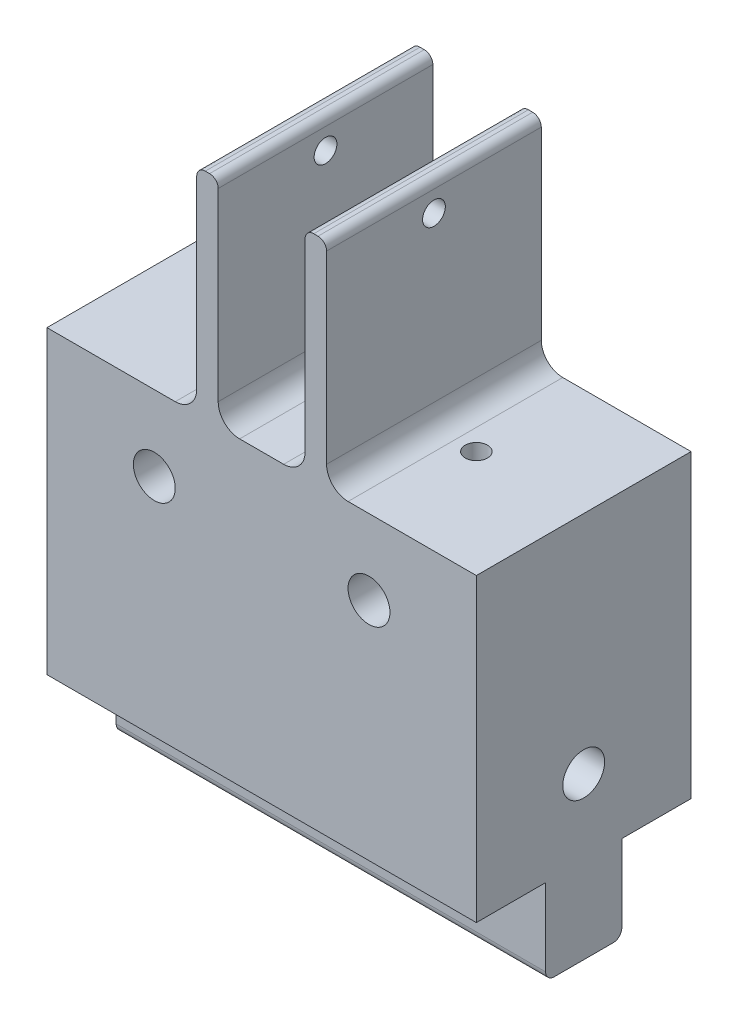
from build123d import *

# Parameters (mm, degrees)
SKETCH1_W               = 100
SKETCH1_H               = 70
BOSS_EXTRUDE1_DEPTH     = 25
CUT_EXTRUDE1_DEPTH      = 79.89866919
CUT_EXTRUDE1_DEPTH_BACK = 79.89866919
SKETCH2_R               = 4.875
CUT_EXTRUDE2_DEPTH      = 109.857705285
CUT_EXTRUDE2_DEPTH_BACK = 109.857705285
SKETCH3_R               = 4.875
SKETCH4_R               = 2.6
CUT_EXTRUDE4_DEPTH      = 20
SKETCH5_W               = 100
SKETCH5_H               = 17.75
BOSS_EXTRUDE2_DEPTH     = 20
FILLET1_R               = 2
SKETCH6_W               = 5
SKETCH6_H               = 50
BOSS_EXTRUDE3_DEPTH     = 50
CUT_EXTRUDE5_DEPTH      = 110.960291151
CUT_EXTRUDE5_DEPTH_BACK = 110.960291151
SKETCH7_R               = 2.65
FILLET2_R               = 5
FILLET3_R               = 2


with BuildPart() as part:
    # Sketch1 → Boss-Extrude1 (new, symmetric)
    with BuildSketch(Plane.XY):
        Rectangle(SKETCH1_W, SKETCH1_H)
    extrude(amount=BOSS_EXTRUDE1_DEPTH, both=True)

    # Sketch2 → Cut-Extrude1 (cut, two sides: drawn at the far end of the back side and taken through both)
    with BuildSketch(Plane.XY.offset(25).offset(-CUT_EXTRUDE1_DEPTH_BACK)):
        with Locations((25, 17.5)):
            Circle(SKETCH2_R)
        with Locations((-25, 17.5)):
            Circle(SKETCH2_R)
    extrude(amount=CUT_EXTRUDE1_DEPTH + CUT_EXTRUDE1_DEPTH_BACK, mode=Mode.SUBTRACT)

    # Sketch3 → Cut-Extrude2 (cut, two sides: drawn at the far end of the back side and taken through both)
    with BuildSketch(Plane.ZY.offset(50).offset(-CUT_EXTRUDE2_DEPTH_BACK)):
        with Locations((0, -17.5)):
            Circle(SKETCH3_R)
    extrude(amount=CUT_EXTRUDE2_DEPTH + CUT_EXTRUDE2_DEPTH_BACK, mode=Mode.SUBTRACT)

    # Sketch4 → Cut-Extrude4 (cut)
    with BuildSketch(Plane(origin=(0, 35, 0), x_dir=(1, 0, 0), z_dir=(0, 1, 0))):
        with Locations(Location((-25, 0, 0), (0, 0, 270))):
            Circle(SKETCH4_R)
        with Locations(Location((25, 0, 0), (0, 0, 270))):
            Circle(SKETCH4_R)
    extrude(amount=-CUT_EXTRUDE4_DEPTH, mode=Mode.SUBTRACT)

    # Sketch5 → Boss-Extrude2 (add)
    with BuildSketch(Plane.XZ.offset(35)):
        Rectangle(SKETCH5_W, SKETCH5_H)
    extrude(amount=BOSS_EXTRUDE2_DEPTH)

    # Fillet1
    fillet1_edges = [part.edges().sort_by_distance(p)[0] for p in [
        (0, -55, 8.875),
        (0, -55, -8.875),
    ]]
    fillet(fillet1_edges, radius=FILLET1_R)

    # Sketch6 → Boss-Extrude3 (add)
    with BuildSketch(Plane(origin=(0, 35, 0), x_dir=(1, 0, 0), z_dir=(0, 1, 0))):
        with Locations((-12.625, 0)):
            Rectangle(SKETCH6_W, SKETCH6_H)
        with Locations((12.625, 0)):
            Rectangle(SKETCH6_W, SKETCH6_H)
    extrude(amount=BOSS_EXTRUDE3_DEPTH)

    # Sketch7 → Cut-Extrude5 (cut, two sides: drawn at the far end of the back side and taken through both)
    with BuildSketch(Plane(origin=(15.125, 0, 0), x_dir=(0, 0, -1), z_dir=(1, 0, 0)).offset(-CUT_EXTRUDE5_DEPTH_BACK)):
        with Locations((0, 78.15)):
            Circle(SKETCH7_R)
    extrude(amount=CUT_EXTRUDE5_DEPTH + CUT_EXTRUDE5_DEPTH_BACK, mode=Mode.SUBTRACT)

    # Fillet2
    fillet2_edges = [part.edges().sort_by_distance(p)[0] for p in [
        (15.125, 35, 0),
        (10.125, 35, 0),
        (-15.125, 35, 0),
        (-10.125, 35, 0),
    ]]
    fillet(fillet2_edges, radius=FILLET2_R)

    # Fillet3
    fillet3_edges = [part.edges().sort_by_distance(p)[0] for p in [
        (15.125, 85, 0),
        (10.125, 85, 0),
        (-15.125, 85, 0),
        (-10.125, 85, 0),
    ]]
    fillet(fillet3_edges, radius=FILLET3_R)


solid = part.part
